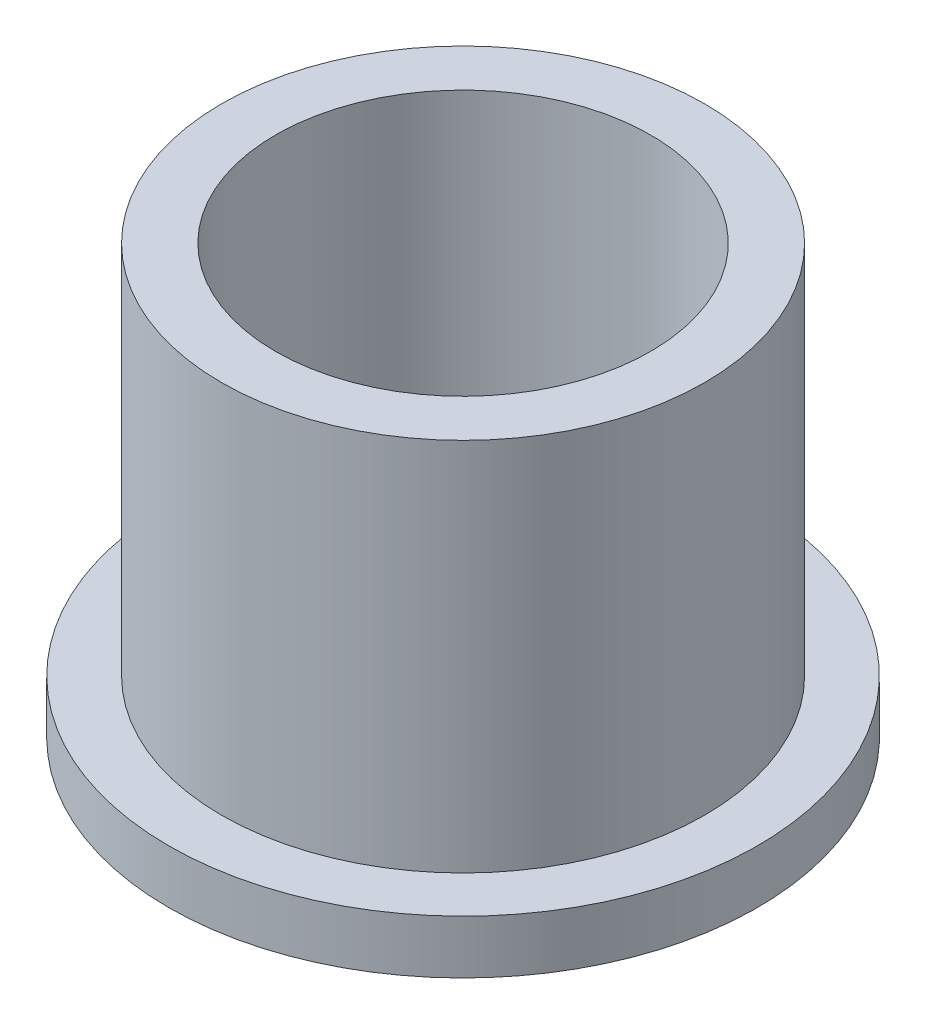
from build123d import *

# Parameters (mm, degrees)
SKETCH2_R           = 7.1628
SKETCH2_R_2         = 5.5626
BOSS_EXTRUDE1_DEPTH = 12.7
SKETCH3_R           = 8.73125
SKETCH3_R_2         = 7.1628
BOSS_EXTRUDE2_DEPTH = 1.5875


with BuildPart() as part:
    # Sketch2 → Boss-Extrude1 (new body)
    with BuildSketch(Plane(origin=(0, 0, 0), x_dir=(1, 0, 0), z_dir=(0, 1, 0))):
        with Locations(Location((0, 0, 0), (0, 0, 270))):
            Circle(SKETCH2_R)
        with Locations(Location((0, 0, 0), (0, 0, 270))):
            Circle(SKETCH2_R_2, mode=Mode.SUBTRACT)
    extrude(amount=BOSS_EXTRUDE1_DEPTH)

    # Sketch3 → Boss-Extrude2 (add)
    with BuildSketch(Plane(origin=(0, 0, 0), x_dir=(1, 0, 0), z_dir=(0, 1, 0))):
        with Locations(Location((0, 0, 0), (0, 0, 270))):
            Circle(SKETCH3_R)
        with Locations(Location((0, 0, 0), (0, 0, 270))):
            Circle(SKETCH3_R_2, mode=Mode.SUBTRACT)
    extrude(amount=BOSS_EXTRUDE2_DEPTH)


solid = part.part
